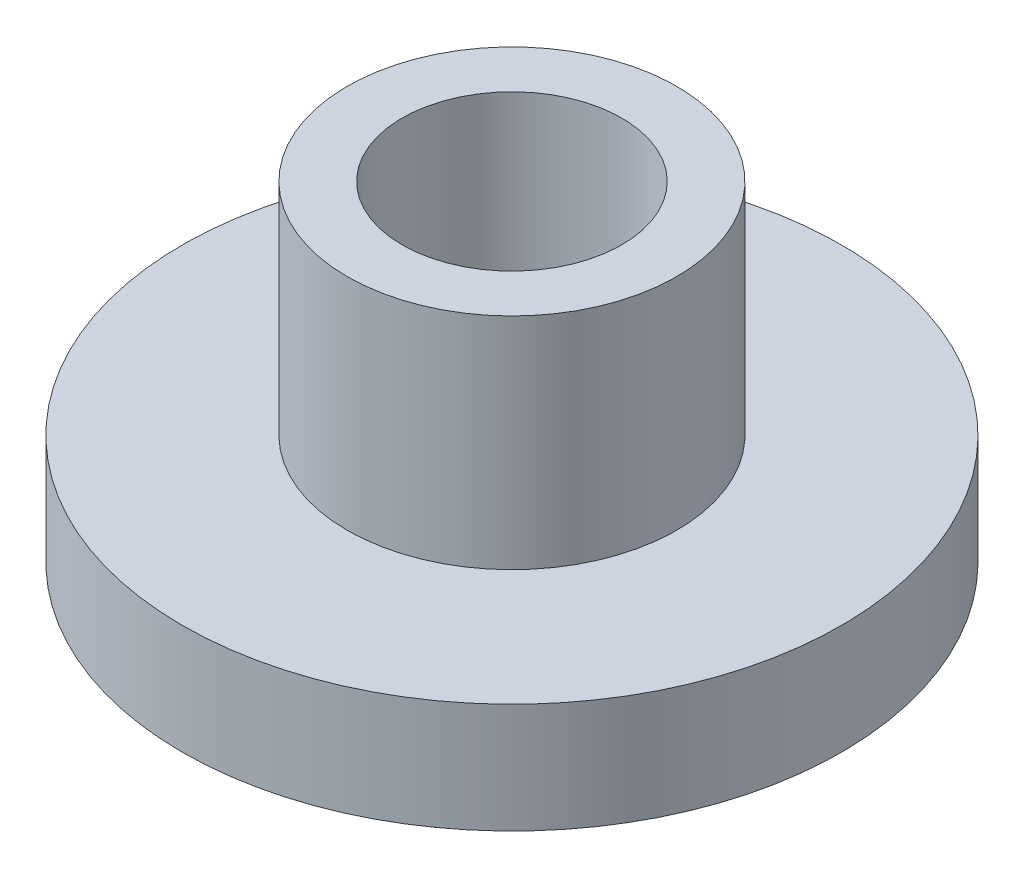
from build123d import *

# Parameters (mm, degrees)
SKETCH1_R          = 38.1
EXTRUDE1_DEPTH     = 12.7
SKETCH2_R          = 19.05
EXTRUDE2_DEPTH     = 25.4
SKETCH3_R          = 12.7
CUT_EXTRUDE1_DEPTH = 66.991135768


with BuildPart() as part:
    # Sketch1 → Extrude1 (new body)
    with BuildSketch(Plane(origin=(0, 0, 0), x_dir=(1, 0, 0), z_dir=(0, 1, 0))):
        with Locations(Location((0, 0, 0), (0, 0, 270))):
            Circle(SKETCH1_R)
    extrude(amount=EXTRUDE1_DEPTH)

    # Sketch2 → Extrude2 (add)
    with BuildSketch(Plane(origin=(0, 12.7, 0), x_dir=(-1, 0, 0), z_dir=(0, 1, 0))):
        with Locations(Location((0, 0, 0), (0, 0, 90))):
            Circle(SKETCH2_R)
    extrude(amount=EXTRUDE2_DEPTH)

    # Sketch3 → Cut-Extrude1 (cut, through all)
    with BuildSketch(Plane(origin=(0, 38.1, 0), x_dir=(-1, 0, 0), z_dir=(0, 1, 0))):
        with Locations(Location((0, 0, 0), (0, 0, 90))):
            Circle(SKETCH3_R)
    extrude(amount=-CUT_EXTRUDE1_DEPTH, mode=Mode.SUBTRACT)


solid = part.part
